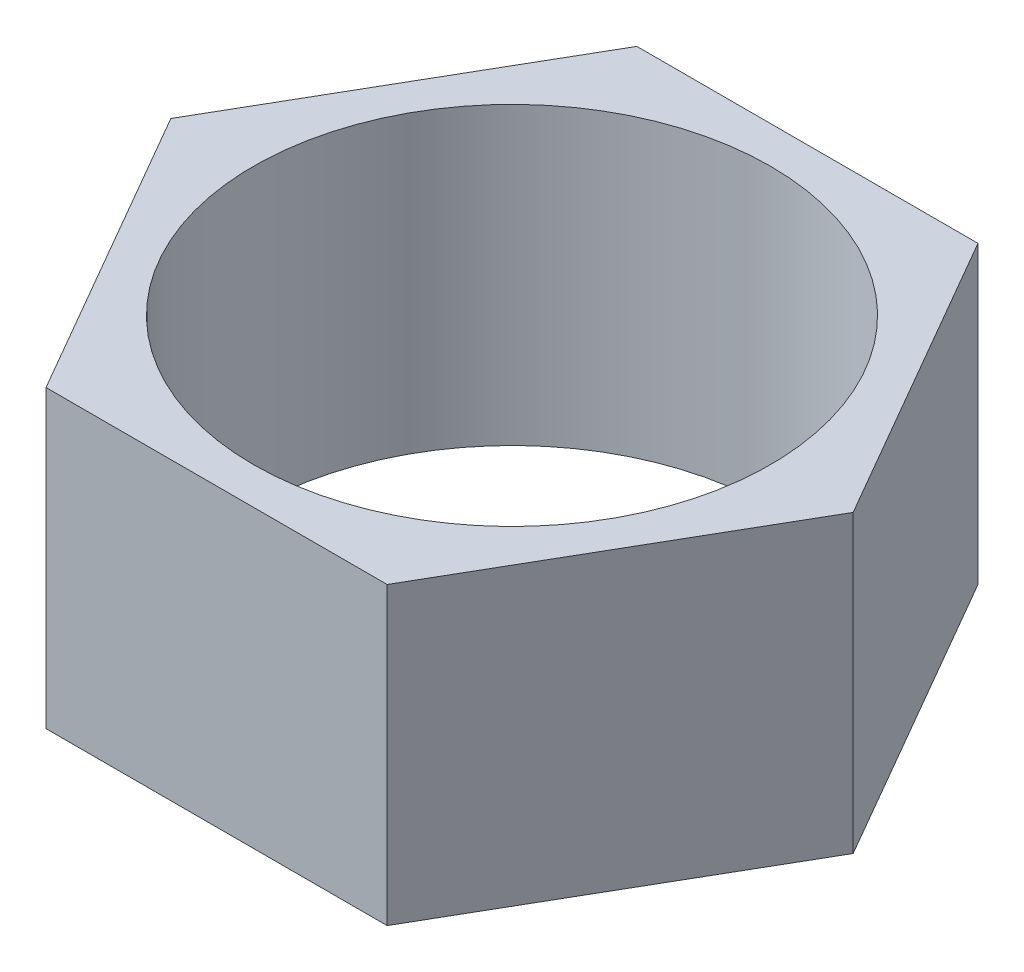
from build123d import *

# Parameters (mm, degrees)
SKETCH1_R           = 8.75
BOSS_EXTRUDE1_DEPTH = 10


with BuildPart() as part:
    # Sketch1 → Boss-Extrude1 (new body)
    with BuildSketch(Plane(origin=(0, 0, 0), x_dir=(1, 0, 0), z_dir=(0, 1, 0))):
        Polygon((11.547005384, 0), (5.773502692, 10), (-5.773502692, 10), (-11.547005384, 0), (-5.773502692, -10), (5.773502692, -10), align=None)
        with Locations(Location((0, 0, 0), (0, 0, 270))):
            Circle(SKETCH1_R, mode=Mode.SUBTRACT)
    extrude(amount=BOSS_EXTRUDE1_DEPTH)


solid = part.part
